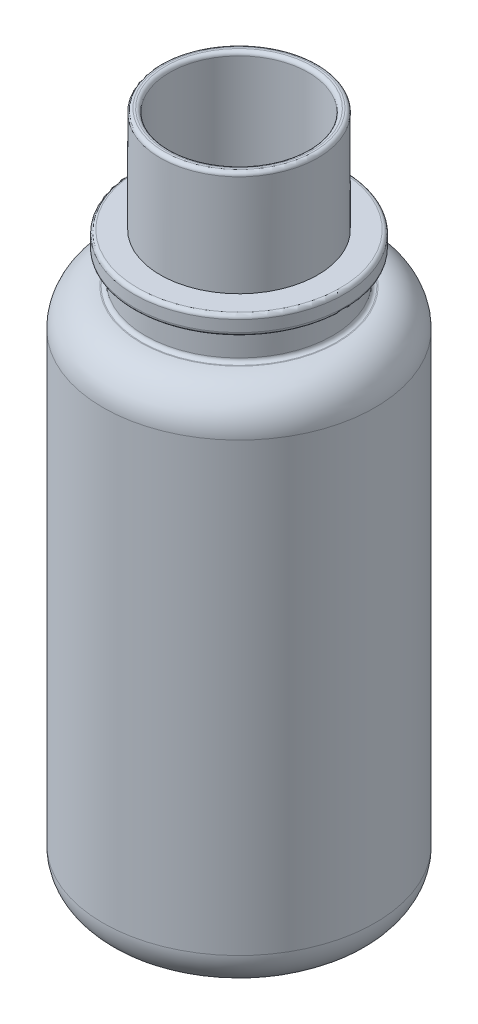
from build123d import *

# Parameters (mm, degrees)
FILLET1_R = 5.08
FILLET2_R = 0.508


with BuildPart() as part:
    # Sketch1 → Revolve1 (revolve)
    with BuildSketch(Plane.XY, mode=Mode.PRIVATE) as revolve1_sk:
        Polygon((0, 0), (18.415, 0), (18.415, 70.612), (12.7, 70.612), (12.7, 74.676), (14.224, 74.676), (14.224, 77.216), (10.668, 77.216), (10.668, 91.44), (9.398, 91.44), (9.398, 75.946), (11.43, 73.464347985), (11.43, 69.342), (17.145, 69.342), (17.145, 1.27), (0, 1.27), align=None)
    revolve(revolve1_sk.sketch.rotate(Axis((0, 0, 0), (0, 1, 0)), 90), axis=Axis((0, 0, 0), (0, 1, 0)))

    # Fillet1
    fillet1_edges = [part.edges().sort_by_distance(p)[0] for p in [
        (0, 1.27, 17.145),
        (0, 69.342, 17.145),
        (0, 70.612, 18.415),
        (0, 0, 18.415),
    ]]
    fillet(fillet1_edges, radius=FILLET1_R)

    # Fillet2
    fillet2_edges = [part.edges().sort_by_distance(p)[0] for p in [
        (0, 69.342, 11.43),
        (0, 73.464347985, 11.43),
        (0, 75.946, 9.398),
        (0, 91.44, 9.398),
        (0, 91.44, 10.668),
        (0, 77.216, 14.224),
        (0, 74.676, 14.224),
        (0, 70.612, 12.7),
    ]]
    fillet(fillet2_edges, radius=FILLET2_R)


solid = part.part
